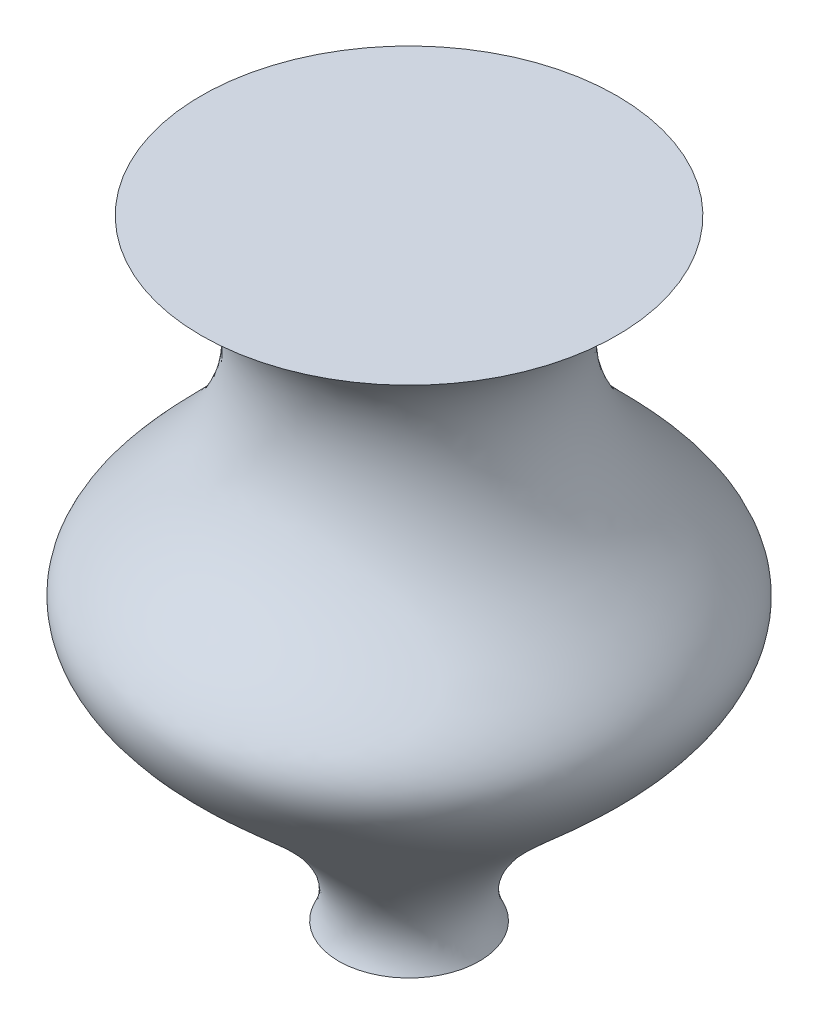
from build123d import *


with BuildPart() as part:
    # 草图3 → 旋转1 (revolve)
    with BuildSketch(Plane.XY):
        with BuildLine():
            Line((-4.443112374, 15.627355247), (-1.039971012, 15.627355247))
            Line((-1.039971012, 15.627355247), (-1.039971012, 5.627355247))
            Line((-1.039971012, 5.627355247), (-2.191803473, 5.627355247))
            add(Edge.make_bspline(
                [(-4.443112374, 15.627355247), (-2.970162428, 15.03654142), (-2.871663149, 12.413883529), (-7.166101807, 9.641043973), (-1.342411225, 7.199814916), (-2.191803473, 5.627355247)],
                knots=[0, 0, 0, 0, 0.328646362, 0.52907903, 1, 1, 1, 1], degree=3))
        make_face()
    revolve(axis=Axis((-1.039971012, 15.627355247, 0), (0, -1, 0)))


solid = part.part
